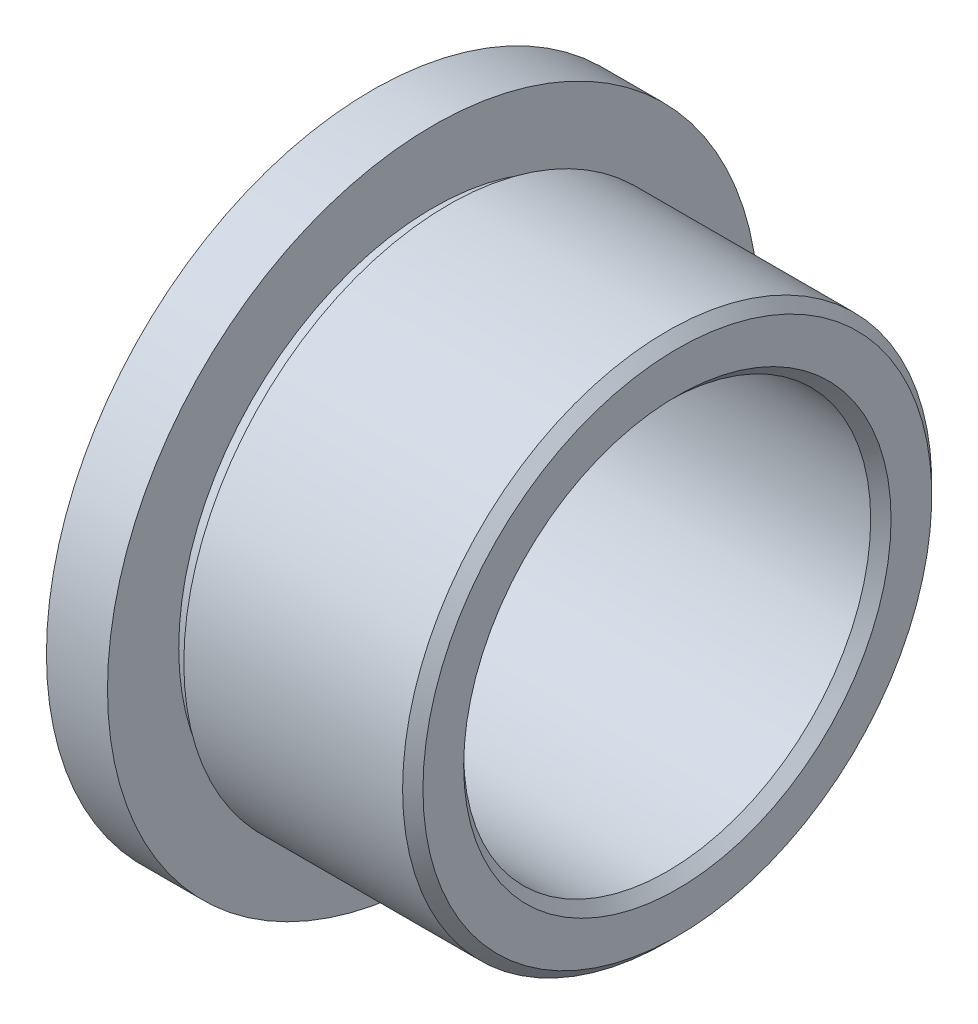
from build123d import *

# Parameters (mm, degrees)
ZKOSIT1_SIZE = 0.5


with BuildPart() as part:
    # Skica1 → Otočit kolem osy1 (revolve)
    with BuildSketch(Plane.XY, mode=Mode.PRIVATE) as oto_it_kolem_osy1_sk:
        Polygon((0, 16), (0, 10), (15, 10), (15, 13), (3.75, 13), (3.75, 12.5), (3, 12.5), (3, 16), align=None)
    revolve(oto_it_kolem_osy1_sk.sketch.rotate(Axis((0, 0, 0), (1, 0, 0)), 90), axis=Axis((0, 0, 0), (1, 0, 0)))

    # Zkosit1
    zkosit1_edges = [part.edges().sort_by_distance(p)[0] for p in [
        (0, 0, -10),
        (15, 0, -10),
        (15, 0, -13),
    ]]
    chamfer(zkosit1_edges, length=ZKOSIT1_SIZE)


solid = part.part
